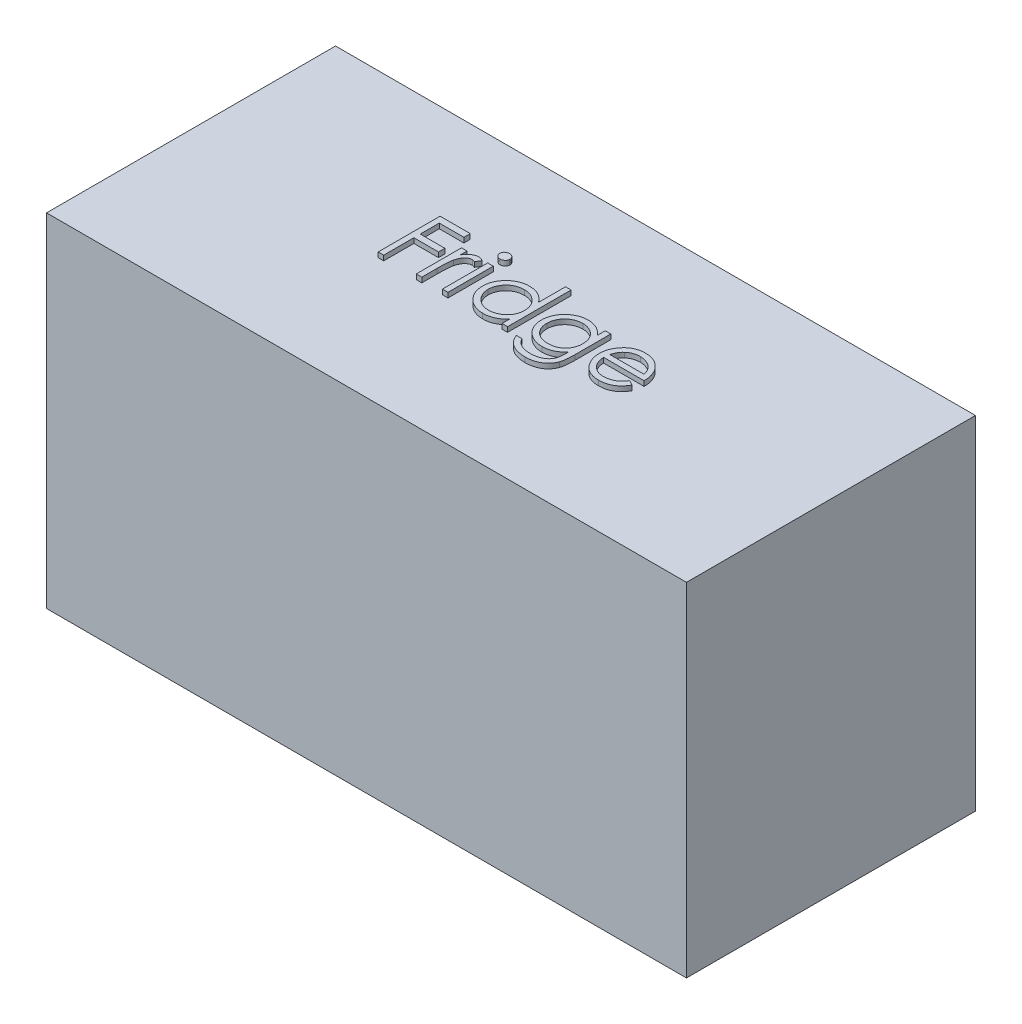
from build123d import *

# Parameters (mm, degrees)
SKETCH1_W           = 1550
SKETCH1_H           = 700
BOSS_EXTRUDE1_DEPTH = 830
SKETCH2_W           = 13.461538462
SKETCH2_H           = 109.615384616
BOSS_EXTRUDE2_DEPTH = 12


with BuildPart() as part:
    # Sketch1 → Boss-Extrude1 (new body)
    with BuildSketch(Plane(origin=(0, 0, 0), x_dir=(1, 0, 0), z_dir=(0, 1, 0))):
        Rectangle(SKETCH1_W, SKETCH1_H)
    extrude(amount=BOSS_EXTRUDE1_DEPTH)

    # Sketch2 → Boss-Extrude2 (add)
    # profile 1 of 7: a face of its own
    with BuildSketch(Plane(origin=(0, 830, 0), x_dir=(1, 0, 0), z_dir=(0, 1, 0))):
        Polygon((-279.412850578, 107.624173924), (-206.335927501, 107.624173924), (-206.335927501, 92.23955854), (-265.951312117, 92.23955854), (-265.951312117, 46.085712386), (-206.335927501, 46.085712386), (-206.335927501, 30.701097001), (-265.951312117, 30.701097001), (-265.951312117, -42.375826076), (-279.412850578, -42.375826076), align=None)
    # profile 2 of 7: a face of its own
    with BuildSketch(Plane(origin=(0, 830, 0), x_dir=(1, 0, 0), z_dir=(0, 1, 0))):
        with BuildLine():
            Line((-187.105158271, 67.23955854), (-173.643619809, 67.23955854))
            Line((-173.643619809, 67.23955854), (-173.643619809, 51.103741232))
            add(Edge.make_bspline(
                [(-173.643619809, 51.103741232), (-172.649815863, 52.606133875), (-170.749173537, 55.47944813), (-167.590047993, 59.27956103), (-164.354190938, 62.42592017), (-161.026111482, 64.933213832), (-157.581335772, 66.810918924), (-154.095466412, 68.186334711), (-150.513660561, 68.999648221), (-148.106720952, 69.108233605), (-146.900831347, 69.162635463)],
                knots=[0, 0, 0, 0, 1.2804753, 2.448899062, 3.506932113, 4.484331642, 5.4025378, 6.288909075, 7.142734305, 8, 8, 8, 8], degree=3))
            add(Edge.make_bspline(
                [(-146.900831347, 69.162635463), (-145.965417355, 69.111612894), (-144.040742275, 69.006630644), (-141.127202712, 68.269023874), (-138.125340487, 67.091394336), (-136.190666748, 65.983956222), (-135.182081347, 65.406625847)],
                knots=[0, 0, 0, 0, 0.901110191, 1.854092781, 2.881294221, 4, 4, 4, 4], degree=3))
            Line((-135.182081347, 65.406625847), (-142.573908271, 53.747972001))
            add(Edge.make_bspline(
                [(-142.573908271, 53.747972001), (-143.221437748, 54.036840549), (-144.450572656, 54.585168352), (-146.248625496, 55.234111644), (-147.906397071, 55.616222323), (-148.962549572, 55.674110214), (-149.454917886, 55.701097001)],
                knots=[0, 0, 0, 0, 1.180555205, 2.24091978, 3.179933427, 4, 4, 4, 4], degree=3))
            add(Edge.make_bspline(
                [(-149.454917886, 55.701097001), (-150.535163608, 55.6290954), (-152.738551749, 55.482233004), (-155.973601724, 54.327712671), (-159.112767674, 52.462345237), (-161.605838917, 50.393583301), (-163.536221183, 48.398677695), (-164.91365942, 46.6566033), (-166.177205718, 44.703233377), (-167.384500878, 42.571961214), (-168.484484916, 40.226396384), (-169.511113596, 37.689972952), (-170.439350578, 34.959753147), (-170.968646759, 33.057645138), (-171.239773655, 32.08330854)],
                knots=[0, 0, 0, 0, 1.125678352, 2.296057538, 3.5422874, 4.923748041, 5.663163013, 6.437101912, 7.23742474, 8.08941207, 8.991984279, 9.93940061, 10.944477711, 12, 12, 12, 12], degree=3))
            add(Edge.make_bspline(
                [(-171.239773655, 32.08330854), (-171.442590514, 31.214286815), (-171.891814443, 29.28946973), (-172.328594637, 26.060247242), (-172.760145407, 22.244947581), (-173.064286194, 17.832950743), (-173.346202285, 12.835274575), (-173.505205809, 7.244305477), (-173.638197547, 1.054304713), (-173.641757556, -3.273167568), (-173.643619809, -5.536883768)],
                knots=[0, 0, 0, 0, 0.566838948, 1.255505196, 2.06880316, 3.007127437, 4.065329342, 5.249902469, 6.561414163, 8, 8, 8, 8], degree=3))
            Line((-173.643619809, -5.536883768), (-173.643619809, -42.375826076))
            Line((-173.643619809, -42.375826076), (-187.105158271, -42.375826076))
            Line((-187.105158271, -42.375826076), (-187.105158271, 67.23955854))
        make_face()
    # profile 3 of 7: a face of its own
    with BuildSketch(Plane(origin=(0, 830, 0), x_dir=(1, 0, 0), z_dir=(0, 1, 0))):
        with BuildLine():
            add(Edge.make_bspline(
                [(-116.972946732, 113.393404694), (-116.137604627, 113.354655305), (-114.501844348, 113.27877656), (-112.13641859, 112.628998971), (-109.982546644, 111.527583881), (-108.072072378, 110.049883271), (-106.432705806, 108.31204998), (-105.284961075, 106.28657991), (-104.547286956, 104.098352533), (-104.458206015, 102.571991568), (-104.412850578, 101.794847001)],
                knots=[0, 0, 0, 0, 1.055194115, 2.066272739, 3.074728998, 4.095836921, 5.109056067, 6.073838105, 7.019297344, 8, 8, 8, 8], degree=3))
            add(Edge.make_bspline(
                [(-104.412850578, 101.794847001), (-104.459228856, 101.037876151), (-104.550913224, 99.541434365), (-105.284391292, 97.391142706), (-106.442487199, 95.393816271), (-108.071021155, 93.659357262), (-109.982825198, 92.182473548), (-112.136344591, 91.08084188), (-114.501863813, 90.431121707), (-116.137611207, 90.355235047), (-116.972946732, 90.316481617)],
                knots=[0, 0, 0, 0, 0.96129708, 1.900370562, 2.859976407, 3.87933698, 4.906634145, 5.921202961, 6.938410037, 8, 8, 8, 8], degree=3))
            add(Edge.make_bspline(
                [(-116.972946732, 90.316481617), (-117.798729954, 90.35375534), (-119.406009103, 90.426303774), (-121.736016632, 91.093590248), (-123.871523321, 92.182850524), (-125.785723577, 93.649687028), (-127.381303283, 95.404468338), (-128.542660086, 97.389923789), (-129.274444166, 99.541744701), (-129.366356821, 101.0379804), (-129.412850578, 101.794847001)],
                knots=[0, 0, 0, 0, 1.054934014, 2.053291228, 3.073705704, 4.106921865, 5.123545215, 6.088680038, 7.033164197, 8, 8, 8, 8], degree=3))
            add(Edge.make_bspline(
                [(-129.412850578, 101.794847001), (-129.367375438, 102.571883413), (-129.278059392, 104.098031953), (-128.542111557, 106.287819078), (-127.390976939, 108.301312013), (-125.784667073, 110.059547702), (-123.87180449, 111.527209192), (-121.735943983, 112.616251257), (-119.406028295, 113.283594373), (-117.798736467, 113.356134987), (-116.972946732, 113.393404694)],
                knots=[0, 0, 0, 0, 0.98631895, 1.937192651, 2.907499808, 3.917963147, 4.944918757, 5.95915025, 6.951458133, 8, 8, 8, 8], degree=3))
        make_face()
    # profile 4 of 7: a face of its own
    with BuildSketch(Plane(origin=(0, 830, 0), x_dir=(1, 0, 0), z_dir=(0, 1, 0))):
        with Locations((-116.912850578, 12.431866232)):
            Rectangle(SKETCH2_W, SKETCH2_H)
    # profile 5 of 7: a face of its own
    with BuildSketch(Plane(origin=(0, 830, 0), x_dir=(1, 0, 0), z_dir=(0, 1, 0))):
        with BuildLine():
            Line((34.048687883, 111.47032777), (34.048687883, -42.375826076))
            Line((34.048687883, -42.375826076), (20.587149422, -42.375826076))
            Line((20.587149422, -42.375826076), (20.587149422, -23.415489537))
            add(Edge.make_bspline(
                [(20.587149422, -23.415489537), (19.069201252, -25.131472135), (16.106906311, -28.480233753), (11.159429827, -32.855184003), (5.915079345, -36.471397783), (0.39930844, -39.392108456), (-5.382901989, -41.586053728), (-11.418734301, -43.145460548), (-17.710650624, -44.148053483), (-22.007180115, -44.248168706), (-24.184485194, -44.298902999)],
                knots=[0, 0, 0, 0, 1.074387032, 2.096679803, 3.090159297, 4.057316773, 5.018401886, 5.985159533, 6.978961417, 8, 8, 8, 8], degree=3))
            add(Edge.make_bspline(
                [(-24.184485194, -44.298902999), (-26.120254644, -44.246344187), (-29.93767771, -44.142695884), (-35.553209588, -43.338597157), (-40.957163136, -42.047284801), (-46.154644821, -40.251532394), (-51.112022483, -37.869497181), (-55.871740911, -35.017729408), (-60.409141998, -31.621693833), (-64.655065096, -27.739349761), (-68.56500797, -23.522421739), (-71.996205368, -19.024755444), (-74.857051647, -14.265799563), (-77.24934082, -9.305807254), (-79.092041296, -4.106596416), (-80.376625622, 1.313853638), (-81.179787623, 6.949133933), (-81.283393081, 10.786542065), (-81.335927501, 12.732347001)],
                knots=[0, 0, 0, 0, 1.033919861, 2.038935746, 3.024066025, 3.998881131, 4.97069526, 5.957263378, 6.95902576, 7.993208707, 9.027059324, 10.027763471, 11.009749337, 11.988697705, 12.965288445, 13.950418724, 14.960734635, 16, 16, 16, 16], degree=3))
            add(Edge.make_bspline(
                [(-81.335927501, 12.732347001), (-81.282228728, 14.637934297), (-81.176069149, 18.405177582), (-80.38521687, 23.94569321), (-79.055316499, 29.282190099), (-77.188980171, 34.397487665), (-74.795753529, 39.297775529), (-71.8845498, 43.986519458), (-68.455158741, 48.476636492), (-64.501484155, 52.662546213), (-60.218565434, 56.529143967), (-55.63676268, 59.889531629), (-50.870050623, 62.791682293), (-45.84449303, 65.091116992), (-40.634474252, 66.951507186), (-35.193612291, 68.238634391), (-29.544544634, 68.997091015), (-25.709237831, 69.106923765), (-23.763812117, 69.162635463)],
                knots=[0, 0, 0, 0, 1.020392517, 2.01726096, 2.990465484, 3.961182959, 4.928053699, 5.906110375, 6.912531644, 7.948652711, 8.985773172, 9.998621852, 10.987621588, 11.969261332, 12.953316658, 13.946091881, 14.958173133, 16, 16, 16, 16], degree=3))
            add(Edge.make_bspline(
                [(-23.763812117, 69.162635463), (-21.525948928, 69.095474204), (-17.133272186, 68.963644117), (-10.709049835, 67.861942674), (-4.632437955, 66.012105054), (1.131547223, 63.479621569), (6.54854266, 60.1881608), (11.658255828, 56.213098749), (16.37182681, 51.441935345), (19.160619205, 47.858582197), (20.587149422, 46.025616232)],
                knots=[0, 0, 0, 0, 1.031072012, 2.023879775, 2.993683497, 3.952812103, 4.918022106, 5.908088563, 6.929940113, 8, 8, 8, 8], degree=3))
            Line((20.587149422, 46.025616232), (20.587149422, 111.47032777))
            Line((20.587149422, 111.47032777), (34.048687883, 111.47032777))
        make_face()
        with BuildLine():
            add(Edge.make_bspline(
                [(-23.583523655, 55.701097001), (-25.551280993, 55.631083956), (-29.435320991, 55.49288934), (-35.137206794, 54.41402526), (-40.593495969, 52.618971216), (-45.776899152, 50.164032595), (-50.605537007, 47.07708674), (-54.920980043, 43.34331317), (-58.758524387, 39.064583992), (-61.986021425, 34.260207832), (-64.617042722, 29.109718215), (-66.467058376, 23.725813725), (-67.687168979, 18.205600401), (-67.811819861, 14.461485296), (-67.87438904, 12.582106617)],
                knots=[0, 0, 0, 0, 1.031046209, 2.035121221, 3.029706178, 4.034933723, 5.034054252, 6.02443088, 7.017295772, 8.038157696, 9.050218397, 10.03989886, 11.016116709, 12, 12, 12, 12], degree=3))
            add(Edge.make_bspline(
                [(-67.87438904, 12.582106617), (-67.794465041, 10.713959166), (-67.634930318, 6.984986772), (-66.488471987, 1.457247767), (-64.565048839, -3.927925464), (-61.940389008, -9.124825186), (-58.653819377, -13.949858059), (-54.844305696, -18.310149026), (-50.475007926, -22.059702809), (-45.635257622, -25.198455964), (-40.466344605, -27.733992573), (-35.030604685, -29.498234267), (-29.430220193, -30.637282007), (-25.622263027, -30.770331015), (-23.703715963, -30.837364537)],
                knots=[0, 0, 0, 0, 0.979072187, 1.954306742, 2.945804271, 3.96968567, 4.997920485, 5.998718438, 6.996577872, 8.005894225, 9.015743152, 10.005417472, 10.995077863, 12, 12, 12, 12], degree=3))
            add(Edge.make_bspline(
                [(-23.703715963, -30.837364537), (-21.756008702, -30.766223226), (-17.882212136, -30.624730214), (-12.16341037, -29.541247416), (-6.61362625, -27.751156058), (-1.30845932, -25.269764912), (3.633660587, -22.19444966), (8.069283913, -18.594145758), (11.819968272, -14.406866439), (14.99965154, -9.805018451), (17.492883684, -4.760218603), (19.309000507, 0.611246715), (20.382739325, 6.309564492), (20.518070596, 10.203732791), (20.587149422, 12.191481617)],
                knots=[0, 0, 0, 0, 1.01762866, 2.023962475, 3.030623092, 4.058876274, 5.077231937, 6.066672613, 7.034107872, 8.005628644, 8.981990164, 9.965428785, 10.961468474, 12, 12, 12, 12], degree=3))
            add(Edge.make_bspline(
                [(20.587149422, 12.191481617), (20.546021292, 13.705960067), (20.465068116, 16.686932925), (19.846615136, 21.063826535), (18.862832576, 25.252414793), (17.476568146, 29.257101467), (15.6555131, 33.055744984), (13.459180276, 36.675620422), (10.848946716, 40.09790091), (7.866831169, 43.275461095), (4.602608203, 46.173738049), (1.148556461, 48.760776936), (-2.53624698, 50.886010054), (-6.389834276, 52.644921689), (-10.418891467, 54.044599542), (-14.656203745, 54.978357846), (-19.056731756, 55.619514462), (-22.058705559, 55.673616495), (-23.583523655, 55.701097001)],
                knots=[0, 0, 0, 0, 1.050140795, 2.067009409, 3.05949893, 4.030605086, 5.00011959, 5.97591094, 6.962425594, 7.979863591, 8.993523472, 9.986985069, 10.967611495, 11.937549037, 12.921786183, 13.919465291, 14.943216303, 16, 16, 16, 16], degree=3))
        make_face(mode=Mode.SUBTRACT)
    # profile 6 of 7: a face of its own
    with BuildSketch(Plane(origin=(0, 830, 0), x_dir=(1, 0, 0), z_dir=(0, 1, 0))):
        with BuildLine():
            Line((160.971764806, 67.23955854), (174.433303268, 67.23955854))
            Line((174.433303268, 67.23955854), (174.433303268, -19.749624153))
            add(Edge.make_bspline(
                [(174.433303268, -19.749624153), (174.421430015, -21.602663922), (174.398511776, -25.179477037), (174.233470151, -30.351403307), (173.885441128, -35.128521258), (173.490783355, -39.532618055), (172.923066942, -43.543279914), (172.22979406, -47.1724744), (171.448264953, -50.423684216), (170.761684205, -52.426177403), (170.436909037, -53.37342223)],
                knots=[0, 0, 0, 0, 1.307562039, 2.523909702, 3.650326591, 4.686913197, 5.643429486, 6.506965704, 7.293745905, 8, 8, 8, 8], degree=3))
            add(Edge.make_bspline(
                [(170.436909037, -53.37342223), (169.957370234, -54.604704583), (169.012630529, -57.030454742), (167.243246238, -60.469068491), (165.261793226, -63.706770912), (162.99864677, -66.725518826), (160.464040883, -69.510157927), (157.717691219, -72.121186467), (154.706111587, -74.50336507), (151.431023921, -76.615592103), (147.967925355, -78.517894424), (144.318806695, -80.165604446), (140.504245051, -81.600754887), (136.48840684, -82.675731847), (132.334253934, -83.607219872), (127.992935459, -84.213420691), (123.489815596, -84.626008897), (120.427870736, -84.664161739), (118.874409037, -84.683518383)],
                knots=[0, 0, 0, 0, 0.981931301, 1.934503488, 2.87077864, 3.801706999, 4.735015492, 5.667491629, 6.616593066, 7.585388521, 8.561939025, 9.551802639, 10.560317337, 11.588439944, 12.640189604, 13.723962949, 14.845264515, 16, 16, 16, 16], degree=3))
            add(Edge.make_bspline(
                [(118.874409037, -84.683518383), (116.607920411, -84.646811849), (112.180859187, -84.575114124), (105.726359501, -83.739789192), (99.596300075, -82.558887489), (93.871680502, -80.771512019), (88.588676351, -78.584212459), (83.7833674, -76.073000189), (79.498891363, -73.193458384), (75.636448234, -69.914861201), (72.150380086, -66.016417703), (68.870639087, -61.422181526), (65.713741578, -56.062171991), (63.863657098, -52.128198567), (62.894841729, -50.068133768)],
                knots=[0, 0, 0, 0, 1.157897085, 2.2616841, 3.32207898, 4.345638746, 5.321241055, 6.241986252, 7.112515963, 7.955008012, 8.825025602, 9.77857164, 10.836726669, 12, 12, 12, 12], degree=3))
            Line((62.894841729, -50.068133768), (76.356380191, -50.068133768))
            add(Edge.make_bspline(
                [(76.356380191, -50.068133768), (77.439046304, -51.786957015), (79.555525236, -55.147044808), (83.513317277, -59.497608634), (87.850731263, -63.215609978), (92.714146257, -66.211786009), (98.123798346, -68.470777069), (104.082942039, -70.081146916), (110.640068685, -71.045272639), (115.205135007, -71.161470959), (117.582341729, -71.221979922)],
                knots=[0, 0, 0, 0, 0.997731894, 1.950442991, 2.880492273, 3.800895997, 4.748200782, 5.754801363, 6.83083817, 8, 8, 8, 8], degree=3))
            add(Edge.make_bspline(
                [(117.582341729, -71.221979922), (119.929494173, -71.160687831), (124.454569144, -71.042522814), (130.961619246, -70.080716635), (136.901402306, -68.470426617), (142.239696618, -66.215781492), (146.91351527, -63.453621212), (150.942600611, -60.367903737), (154.205943874, -56.888717894), (156.400785303, -53.683783347), (157.765126057, -50.828463503), (158.633936204, -48.370495105), (159.339963466, -45.591086062), (159.930527932, -42.499554509), (160.417852791, -39.091483492), (160.726547749, -35.359080491), (160.949653959, -31.310828105), (160.964224095, -28.503979325), (160.971764806, -27.051306845)],
                knots=[0, 0, 0, 0, 1.570740765, 3.028230971, 4.391408896, 5.680370741, 6.894727393, 8.017376726, 9.065722033, 10.075533815, 10.603371122, 11.180248986, 11.817768598, 12.521299649, 13.286540596, 14.121245857, 15.027658897, 16, 16, 16, 16], degree=3))
            Line((160.971764806, -27.051306845), (160.971764806, -21.372220306))
            add(Edge.make_bspline(
                [(160.971764806, -21.372220306), (159.605431203, -22.998297542), (156.896797387, -26.221849812), (152.219054795, -30.445919956), (147.109758411, -34.083896969), (141.577606594, -37.067552734), (135.758110501, -39.453899503), (129.714300626, -41.122883542), (123.500355403, -42.201164966), (119.289548982, -42.317192804), (117.161668653, -42.375826076)],
                knots=[0, 0, 0, 0, 1.012485704, 2.007162095, 2.997754123, 3.998611389, 4.999708251, 5.992315798, 6.98544096, 8, 8, 8, 8], degree=3))
            add(Edge.make_bspline(
                [(117.161668653, -42.375826076), (115.908685677, -42.353753513), (113.417547496, -42.309869593), (109.716629758, -41.925921989), (106.070325258, -41.368833033), (102.48713796, -40.551057077), (98.9618974, -39.501411654), (95.500429166, -38.189265707), (92.074706599, -36.705760639), (88.746999548, -34.958354777), (85.550451088, -33.014255912), (82.509171725, -30.908303453), (79.639091478, -28.651519671), (76.967527644, -26.221650823), (74.497984582, -23.622213704), (72.19724738, -20.880918574), (70.103361077, -17.959486802), (68.173358681, -14.911188622), (66.499463665, -11.715720459), (65.030133444, -8.442373512), (63.752587514, -5.098146891), (62.734070296, -1.671844206), (61.956165442, 1.83437446), (61.377155714, 5.414765126), (61.048744357, 9.080353167), (60.997533327, 11.549839561), (60.971764806, 12.792443155)],
                knots=[0, 0, 0, 0, 1.028754217, 2.045334182, 3.052854819, 4.056607503, 5.061168794, 6.071104265, 7.095078842, 8.125279047, 9.155117945, 10.165957491, 11.161587969, 12.151493252, 13.128948131, 14.104219989, 15.088194871, 16.07871515, 17.064853787, 18.047899887, 19.02414258, 20.002704429, 20.980574569, 21.971845993, 22.979467364, 24, 24, 24, 24], degree=3))
            add(Edge.make_bspline(
                [(60.971764806, 12.792443155), (60.99401479, 14.035432984), (61.038428579, 16.516598361), (61.422041979, 20.197143449), (61.969250098, 23.828404959), (62.83529734, 27.372953889), (63.877691162, 30.871157536), (65.168701415, 34.297177096), (66.720933958, 37.652056058), (68.478494658, 40.938278834), (70.4535272, 44.111748046), (72.619204949, 47.125747156), (74.978142417, 49.958097381), (77.497795944, 52.637372604), (80.20893096, 55.137722313), (83.110144918, 57.453077951), (86.172839785, 59.622250506), (89.406507642, 61.59845067), (92.761252864, 63.346261235), (96.151845056, 64.941086817), (99.623197985, 66.206834797), (103.110592532, 67.32211047), (106.675446022, 68.112190265), (110.274048605, 68.721714919), (113.918720224, 69.093060106), (116.359558583, 69.139413748), (117.582341729, 69.162635463)],
                knots=[0, 0, 0, 0, 1.008818848, 2.013730394, 3.001654427, 3.987803273, 4.973046549, 5.963777569, 6.957074694, 7.972068341, 8.987420212, 9.989399531, 10.982630087, 11.977756091, 12.973280677, 13.973972381, 14.989194003, 16.018387222, 17.047741039, 18.059210846, 19.057554164, 20.045176975, 21.029480261, 22.018708529, 23.007435371, 24, 24, 24, 24], degree=3))
            add(Edge.make_bspline(
                [(117.582341729, 69.162635463), (119.598810543, 69.104492322), (123.580716857, 68.989677485), (129.440616961, 68.088771254), (135.095284388, 66.652456396), (140.576627917, 64.59464366), (145.929298674, 61.785356303), (151.135655331, 58.084944245), (156.210761081, 53.460215399), (159.342668104, 49.913664069), (160.971764806, 48.068885463)],
                knots=[0, 0, 0, 0, 0.96728863, 1.910097829, 2.838038873, 3.762875196, 4.71315279, 5.730631239, 6.819562287, 8, 8, 8, 8], degree=3))
            Line((160.971764806, 48.068885463), (160.971764806, 67.23955854))
        make_face()
        with BuildLine():
            add(Edge.make_bspline(
                [(118.664072499, 55.701097001), (116.695613761, 55.634194194), (112.798482858, 55.501740822), (107.086125323, 54.370967401), (101.571399604, 52.599000258), (96.359738396, 50.064316739), (91.478005114, 46.974563685), (87.146227094, 43.231408502), (83.357444976, 38.956571493), (80.152461906, 34.188703764), (77.601117629, 29.044891958), (75.79497108, 23.623003353), (74.62711294, 18.010646518), (74.498213566, 14.180392097), (74.433303268, 12.25157777)],
                knots=[0, 0, 0, 0, 1.026226791, 2.031711442, 3.026614839, 4.04107745, 5.047145931, 6.032893242, 7.017642609, 8.019221815, 9.021877557, 10.003543541, 10.994637589, 12, 12, 12, 12], degree=3))
            add(Edge.make_bspline(
                [(74.433303268, 12.25157777), (74.464407132, 10.797294661), (74.525579337, 7.937145061), (75.11373267, 3.739806716), (76.064345461, -0.257921011), (77.411654303, -4.056279916), (79.081055512, -7.67705684), (81.180728554, -11.095309757), (83.651484483, -14.314082875), (86.47398468, -17.309569237), (89.584401046, -20.037896455), (92.958081016, -22.435241054), (96.590448862, -24.395986236), (100.392169299, -26.090593562), (104.455487412, -27.328267902), (108.721876815, -28.272787003), (113.22152095, -28.813162327), (116.288881205, -28.880139375), (117.852774422, -28.914287614)],
                knots=[0, 0, 0, 0, 1.039728707, 2.044842319, 3.024901384, 3.974314358, 4.923051295, 5.871625912, 6.837440708, 7.820715446, 8.810779094, 9.792721783, 10.773906224, 11.758876063, 12.764959493, 13.806266761, 14.881525401, 16, 16, 16, 16], degree=3))
            add(Edge.make_bspline(
                [(117.852774422, -28.914287614), (119.436935487, -28.881390084), (122.534745664, -28.817059312), (127.059214367, -28.264052231), (131.346331811, -27.371681819), (135.392167055, -26.104695019), (139.211995958, -24.488048564), (142.762908013, -22.442193527), (146.121041501, -20.112289297), (149.179173341, -17.394631545), (151.94449472, -14.399560331), (154.35438473, -11.140493402), (156.407861116, -7.666471157), (158.108332681, -3.977885199), (159.406527146, -0.046070068), (160.27733736, 4.11914518), (160.886197867, 8.497805416), (160.942808925, 11.498174681), (160.971764806, 13.03282777)],
                knots=[0, 0, 0, 0, 1.121943988, 2.193949579, 3.223793937, 4.220241907, 5.192961521, 6.155822191, 7.11847367, 8.083710714, 9.04790392, 10.001595906, 10.949595423, 11.902125208, 12.873731292, 13.87582262, 14.913508608, 16, 16, 16, 16], degree=3))
            add(Edge.make_bspline(
                [(160.971764806, 13.03282777), (160.914354742, 15.030735797), (160.80219565, 18.933946012), (159.743746036, 24.621378925), (158.037165599, 29.968607801), (155.643733359, 34.958721053), (152.644504415, 39.538844612), (149.032039466, 43.624152232), (144.868638154, 47.219903228), (140.166262432, 50.215540093), (135.107086212, 52.635487283), (129.813320665, 54.450991803), (124.29282507, 55.47931959), (120.551121803, 55.62674573), (118.664072499, 55.701097001)],
                knots=[0, 0, 0, 0, 1.070913519, 2.092188694, 3.091357305, 4.074328408, 5.051968682, 6.018948707, 6.99050112, 7.9935919, 9.000589572, 9.992915277, 10.987769056, 12, 12, 12, 12], degree=3))
        make_face(mode=Mode.SUBTRACT)
    # profile 7 of 7: a face of its own
    with BuildSketch(Plane(origin=(0, 830, 0), x_dir=(1, 0, 0), z_dir=(0, 1, 0))):
        with BuildLine():
            Line((295.166476345, -7.76044146), (307.12561096, -14.040489537))
            add(Edge.make_bspline(
                [(307.12561096, -14.040489537), (306.172614021, -15.73091802), (304.318459372, -19.019822427), (301.129855891, -23.538330733), (297.787338495, -27.60323284), (294.14002558, -31.10593231), (290.297039339, -34.159563094), (286.23706842, -36.831184154), (281.938976231, -39.107692168), (277.402559455, -41.025657649), (272.589721549, -42.500350253), (267.488799417, -43.541959721), (262.090021044, -44.185814092), (258.389470478, -44.26060584), (256.494601345, -44.298902999)],
                knots=[0, 0, 0, 0, 1.120438281, 2.179929193, 3.190490725, 4.156257408, 5.095198341, 6.022838206, 6.959905092, 7.901321166, 8.864066838, 9.862729781, 10.905609505, 12, 12, 12, 12], degree=3))
            add(Edge.make_bspline(
                [(256.494601345, -44.298902999), (254.388516593, -44.249738342), (250.280155379, -44.153832339), (244.299880503, -43.327012435), (238.669334, -41.978197062), (233.388832428, -40.09395957), (228.471307318, -37.632788537), (223.906984969, -34.634525031), (219.671862431, -31.114571259), (215.899396323, -27.042437967), (212.503229922, -22.684639797), (209.506409065, -18.143673319), (207.001090592, -13.430963699), (204.963121583, -8.576512668), (203.317198799, -3.610917231), (202.170054352, 1.511002808), (201.508779438, 6.77538499), (201.407446058, 10.336699378), (201.356380191, 12.131385463)],
                knots=[0, 0, 0, 0, 1.145258523, 2.234067595, 3.276747158, 4.290159414, 5.277019952, 6.260822364, 7.254936242, 8.264827045, 9.274100331, 10.257902744, 11.220704747, 12.172965371, 13.118907548, 14.062713208, 15.023725156, 16, 16, 16, 16], degree=3))
            add(Edge.make_bspline(
                [(201.356380191, 12.131385463), (201.401771962, 13.815449623), (201.491732459, 17.153042396), (202.058766204, 22.092994304), (203.06369305, 26.894213698), (204.442678362, 31.56069004), (206.223446056, 36.084610068), (208.401969736, 40.46872708), (210.98164307, 44.708375931), (212.973329088, 47.382795947), (213.976572499, 48.729943155)],
                knots=[0, 0, 0, 0, 1.024358464, 2.0301432, 3.019427413, 4.004406732, 4.986367066, 5.972626655, 6.978780325, 8, 8, 8, 8], degree=3))
            add(Edge.make_bspline(
                [(213.976572499, 48.729943155), (215.335473189, 50.35289473), (218.010228044, 53.547386892), (222.534071845, 57.744743712), (227.432651688, 61.260905505), (232.644578521, 64.175497054), (238.230427409, 66.390081925), (244.115111311, 68.040406878), (250.365636435, 68.965178779), (254.638717328, 69.09580022), (256.825130191, 69.162635463)],
                knots=[0, 0, 0, 0, 1.030682036, 2.02871468, 2.997146059, 3.962720338, 4.930598197, 5.918074684, 6.934738563, 8, 8, 8, 8], degree=3))
            add(Edge.make_bspline(
                [(256.825130191, 69.162635463), (259.072884704, 69.104604796), (263.482466673, 68.990761856), (269.912414717, 67.935347567), (275.996445426, 66.261666657), (281.732124182, 63.897932779), (287.1200325, 60.848237702), (292.125148911, 57.07073021), (296.833070877, 52.681383614), (299.572009971, 49.305817496), (300.965755191, 47.588116232)],
                knots=[0, 0, 0, 0, 1.056321875, 2.072262726, 3.055038591, 4.01806755, 4.982017516, 5.957941055, 6.960871419, 8, 8, 8, 8], degree=3))
            add(Edge.make_bspline(
                [(300.965755191, 47.588116232), (301.914052547, 46.29367703), (303.804335109, 43.7134148), (306.172067967, 39.506079496), (308.227384895, 35.104196881), (309.870226081, 30.43661272), (311.200490418, 25.558630713), (312.162925507, 20.435378796), (312.727337732, 15.068382595), (312.838281904, 11.411530217), (312.894841729, 9.547250847)],
                knots=[0, 0, 0, 0, 0.94817472, 1.890038105, 2.849395472, 3.817997239, 4.812318967, 5.836947057, 6.897266129, 8, 8, 8, 8], degree=3))
            Line((312.894841729, 9.547250847), (214.817918653, 9.547250847))
            add(Edge.make_bspline(
                [(214.817918653, 9.547250847), (214.883901785, 8.102945237), (215.013654954, 5.262776505), (215.618589662, 1.106885801), (216.572108538, -2.85197172), (217.912211222, -6.58410209), (219.535076019, -10.138250413), (221.52303531, -13.488051997), (223.894730479, -16.618248999), (226.540117595, -19.55684061), (229.484707396, -22.173730375), (232.582539419, -24.515949356), (235.877977919, -26.479046359), (239.34503864, -28.072470205), (242.978115146, -29.319883751), (246.77835208, -30.17136178), (250.738271352, -30.74166636), (253.437659953, -30.805080583), (254.811909037, -30.837364537)],
                knots=[0, 0, 0, 0, 1.094153842, 2.151609401, 3.174256925, 4.172055639, 5.149267565, 6.128595816, 7.11444997, 8.118368179, 9.117203808, 10.09244225, 11.054858984, 12.015122123, 12.976791628, 13.957293641, 14.960065497, 16, 16, 16, 16], degree=3))
            add(Edge.make_bspline(
                [(254.811909037, -30.837364537), (256.155529649, -30.811304966), (258.821530689, -30.759597778), (262.791853146, -30.256801596), (266.697832892, -29.443789784), (270.523303603, -28.33421878), (274.190625571, -26.980925118), (277.586863431, -25.347945505), (280.710301243, -23.541527787), (283.629599811, -21.475398857), (286.461213812, -18.946476557), (289.270177516, -15.790659943), (292.282034088, -12.058337323), (294.167302349, -9.249237353), (295.166476345, -7.76044146)],
                knots=[0, 0, 0, 0, 0.99110716, 1.966546729, 2.947904876, 3.932708344, 4.903319531, 5.828989031, 6.710028674, 7.56322171, 8.463672341, 9.504779593, 10.677557249, 12, 12, 12, 12], degree=3))
        make_face()
        with BuildLine():
            add(Edge.make_bspline(
                [(299.433303268, 23.008789309), (298.940590787, 24.79434104), (297.992277866, 28.23095335), (296.01071939, 32.989848655), (293.779081932, 37.219330127), (291.138150587, 40.887028687), (288.145919489, 44.1443221), (284.689697375, 46.990832893), (280.813873368, 49.537295082), (276.538481625, 51.686687916), (272.01097655, 53.51625329), (267.27071118, 54.743043965), (262.433948843, 55.58345292), (259.162479428, 55.66171471), (257.51623596, 55.701097001)],
                knots=[0, 0, 0, 0, 1.154881502, 2.222775134, 3.210006277, 4.132804581, 5.035138423, 5.962687519, 6.919655026, 7.923214229, 8.944639381, 9.960483929, 10.97369054, 12, 12, 12, 12], degree=3))
            add(Edge.make_bspline(
                [(257.51623596, 55.701097001), (256.172688595, 55.674882506), (253.516777922, 55.623061962), (249.603874999, 55.13148499), (245.846173617, 54.31892021), (242.215947005, 53.206136356), (238.760766932, 51.722910534), (235.40956258, 49.983629394), (232.247545598, 47.860418659), (230.270061506, 46.242182024), (229.271043653, 45.424654694)],
                knots=[0, 0, 0, 0, 1.04873581, 2.073130211, 3.073294108, 4.04793562, 5.032784715, 6.005352987, 6.992311501, 8, 8, 8, 8], degree=3))
            add(Edge.make_bspline(
                [(229.271043653, 45.424654694), (228.555617283, 44.777755452), (227.107768673, 43.46858905), (225.173174895, 41.213051627), (223.320868923, 38.78084182), (221.635140947, 36.078907908), (220.088958671, 33.138017379), (218.642102506, 29.982975869), (217.339827702, 26.589841715), (216.607137272, 24.225308605), (216.230178268, 23.008789309)],
                knots=[0, 0, 0, 0, 0.879870761, 1.780643979, 2.707998968, 3.669668524, 4.684282772, 5.740141944, 6.837334558, 8, 8, 8, 8], degree=3))
            Line((216.230178268, 23.008789309), (299.433303268, 23.008789309))
        make_face(mode=Mode.SUBTRACT)
    extrude(amount=BOSS_EXTRUDE2_DEPTH)


solid = part.part
